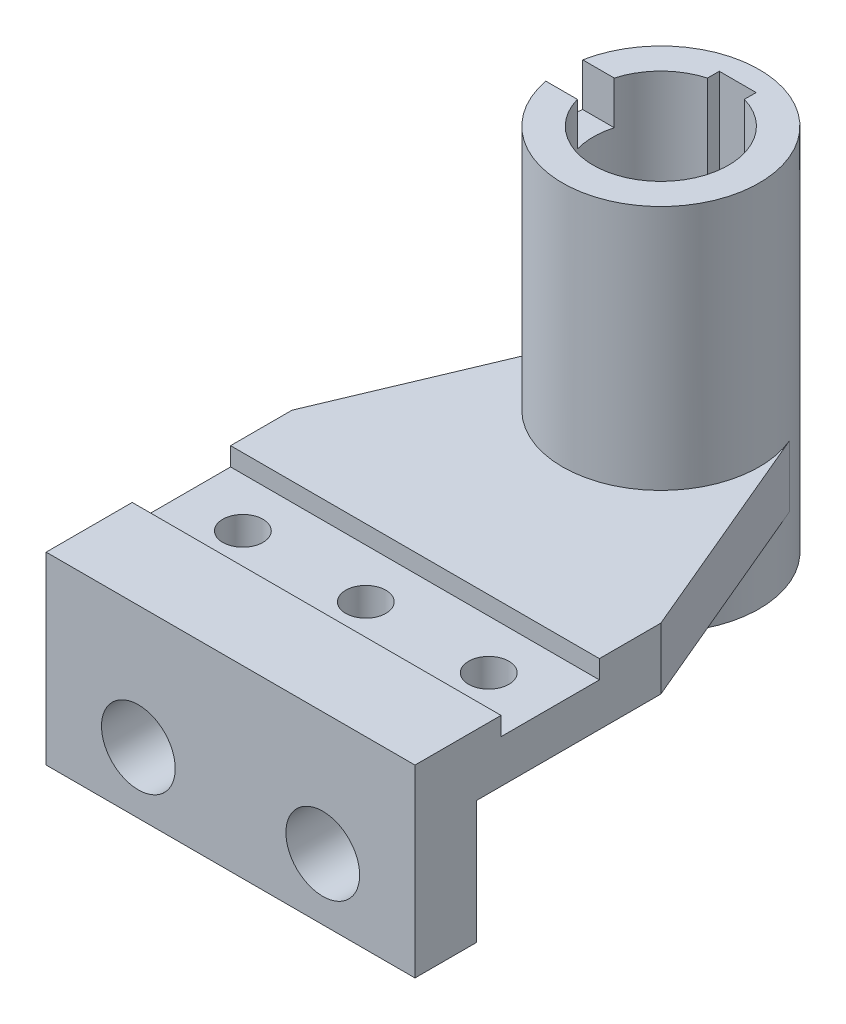
from build123d import *

# Parameters (mm, degrees)
BOSS_EXTRUDE1_DEPTH      = 10
SKETCH3_W                = 60
SKETCH3_H                = 10
BOSS_EXTRUDE2_DEPTH      = 20
SKETCH4_R                = 6
CUT_EXTRUDE1_DEPTH       = 20
SKETCH5_W                = 60
SKETCH5_H                = 16
CUT_EXTRUDE2_DEPTH       = 3
SKETCH6_R                = 3.270829893
CUT_EXTRUDE3_DEPTH       = 20
BOSS_EXTRUDE4_DEPTH      = 40
BOSS_EXTRUDE4_DEPTH_BACK = 20
SKETCH7_R                = 16
SKETCH10_W               = 12.846934043
SKETCH10_H               = 6
CUT_EXTRUDE4_DEPTH       = 7


with BuildPart() as part:
    # Sketch2 → Boss-Extrude1 (new body)
    with BuildSketch(Plane(origin=(0, 0, 0), x_dir=(1, 0, 0), z_dir=(0, 1, 0))):
        with BuildLine():
            Line((-26.355501721, -12.852372891), (33.644498279, -12.852372891))
            Line((33.644498279, -12.852372891), (33.644498279, 27.147627109))
            Line((33.644498279, 27.147627109), (18.389502388, 63.359297885))
            ThreePointArc((18.389502388, 63.359297885), (3.644498279, 73.147627109), (-11.10050583, 63.359297885))
            Line((-11.10050583, 63.359297885), (-26.355501721, 27.147627109))
            Line((-26.355501721, 27.147627109), (-26.355501721, -12.852372891))
        make_face()
        with BuildLine():
            Line((0.644498279, 69.647627109), (6.644498279, 69.647627109))
            Line((6.644498279, 69.647627109), (6.644498279, 67.730632354))
            ThreePointArc((6.644498279, 67.730632354), (3.644498279, 46.147627109), (0.644498279, 67.730632354))
            Line((0.644498279, 67.730632354), (0.644498279, 69.647627109))
        make_face(mode=Mode.SUBTRACT)
    extrude(amount=BOSS_EXTRUDE1_DEPTH)

    # Sketch3 → Boss-Extrude2 (add)
    with BuildSketch(Plane.XZ):
        with Locations((3.644498279, 7.852372891)):
            Rectangle(SKETCH3_W, SKETCH3_H)
    extrude(amount=BOSS_EXTRUDE2_DEPTH)

    # Sketch4 → Cut-Extrude1 (cut)
    with BuildSketch(Plane.XY.offset(12.852372891)):
        with Locations((-11.355501721, -10)):
            Circle(SKETCH4_R)
        with Locations((18.644498279, -10)):
            Circle(SKETCH4_R)
    extrude(amount=-CUT_EXTRUDE1_DEPTH, mode=Mode.SUBTRACT)

    # Sketch5 → Cut-Extrude2 (cut)
    with BuildSketch(Plane(origin=(0, 10, 0), x_dir=(1, 0, 0), z_dir=(0, 1, 0))):
        with Locations((3.644498279, 9.147627109)):
            Rectangle(SKETCH5_W, SKETCH5_H)
    extrude(amount=-CUT_EXTRUDE2_DEPTH, mode=Mode.SUBTRACT)

    # Sketch6 → Cut-Extrude3 (cut)
    with BuildSketch(Plane(origin=(0, 7, 0), x_dir=(1, 0, 0), z_dir=(0, 1, 0))):
        with Locations(Location((-16.355501721, 9.147627109, 0), (0, 0, 270))):
            Circle(SKETCH6_R)
        with Locations(Location((3.644498279, 9.147627109, 0), (0, 0, 270))):
            Circle(SKETCH6_R)
        with Locations(Location((23.644498279, 9.147627109, 0), (0, 0, 270))):
            Circle(SKETCH6_R)
    extrude(amount=-CUT_EXTRUDE3_DEPTH, mode=Mode.SUBTRACT)

    # Sketch7 → Boss-Extrude4 (add, two sides: drawn at the far end of the back side and taken through both)
    with BuildSketch(Plane(origin=(0, 10, 0), x_dir=(1, 0, 0), z_dir=(0, 1, 0)).offset(-BOSS_EXTRUDE4_DEPTH_BACK)):
        with Locations(Location((3.644498279, 57.147627109, 0), (0, 0, 270))):
            Circle(SKETCH7_R)
        with BuildLine():
            Line((6.644498279, 67.730632354), (6.644498279, 69.647627109))
            Line((6.644498279, 69.647627109), (0.644498279, 69.647627109))
            Line((0.644498279, 69.647627109), (0.644498279, 67.730632354))
            ThreePointArc((0.644498279, 67.730632354), (3.644498279, 46.147627109), (6.644498279, 67.730632354))
        make_face(mode=Mode.SUBTRACT)
    extrude(amount=BOSS_EXTRUDE4_DEPTH + BOSS_EXTRUDE4_DEPTH_BACK)

    # Sketch10 → Cut-Extrude4 (cut)
    with BuildSketch(Plane(origin=(0, 50, 0), x_dir=(1, 0, 0), z_dir=(0, 1, 0))):
        with Locations((-7.355501722, 57.147627109)):
            Rectangle(SKETCH10_W, SKETCH10_H)
    extrude(amount=-CUT_EXTRUDE4_DEPTH, mode=Mode.SUBTRACT)


solid = part.part
